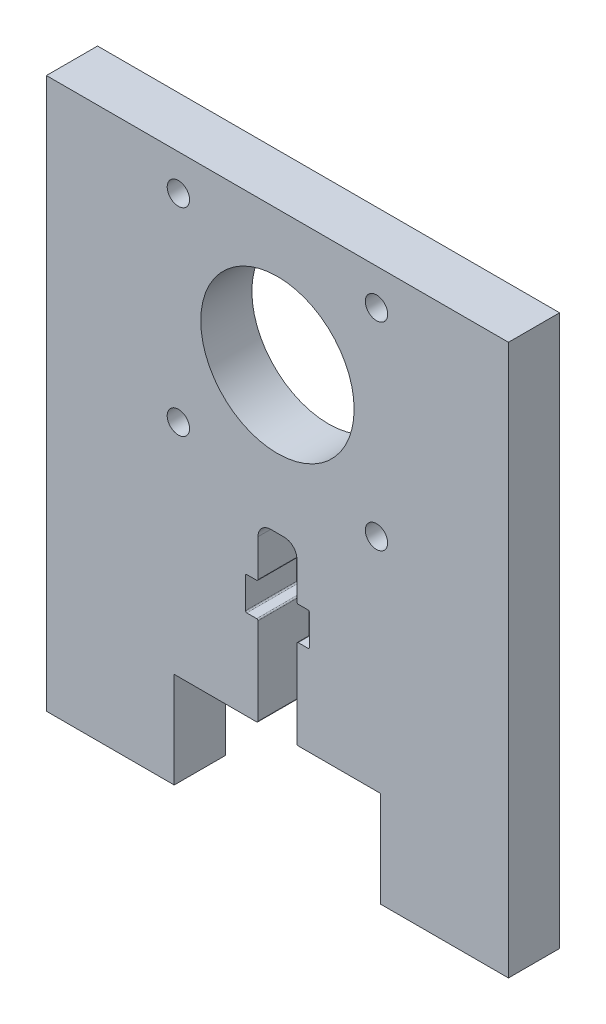
from build123d import *

# Parameters (mm, degrees)
SKETCH1_R           = 12
SKETCH1_R_2         = 1.75
BOSS_EXTRUDE1_DEPTH = 8


with BuildPart() as part:
    # Sketch1 → Boss-Extrude1 (new body)
    with BuildSketch(Plane.XY):
        with BuildLine():
            Line((36.15, 21.15), (-36.15, 21.15))
            Line((-36.15, 21.15), (-36.15, -57))
            Line((-36.15, -57), (-36.15, -65))
            Line((-36.15, -65), (-16.15, -65))
            Line((-16.15, -65), (-16.15, -50))
            Line((-16.15, -50), (-3.25, -50))
            ThreePointArc((-3.25, -50), (-3.108578644, -49.941421356), (-3.05, -49.8))
            Line((-3.05, -49.8), (-3.05, -36.2))
            ThreePointArc((-3.05, -36.2), (-3.108578644, -36.058578644), (-3.25, -36))
            Line((-3.25, -36), (-4.8, -36))
            ThreePointArc((-4.8, -36), (-4.941421356, -35.941421356), (-5, -35.8))
            Line((-5, -35.8), (-5, -31))
            ThreePointArc((-5, -31), (-4.941421356, -30.858578644), (-4.8, -30.8))
            Line((-4.8, -30.8), (-3.25, -30.8))
            ThreePointArc((-3.25, -30.8), (-3.108578644, -30.741421356), (-3.05, -30.6))
            Line((-3.05, -30.6), (-3.05, -24.8))
            ThreePointArc((-3.05, -24.8), (-2.464213562, -23.385786438), (-1.05, -22.8))
            Line((-1.05, -22.8), (1.05, -22.8))
            ThreePointArc((1.05, -22.8), (2.464213562, -23.385786438), (3.05, -24.8))
            Line((3.05, -24.8), (3.05, -30.6))
            ThreePointArc((3.05, -30.6), (3.108578644, -30.741421356), (3.25, -30.8))
            Line((3.25, -30.8), (4.8, -30.8))
            ThreePointArc((4.8, -30.8), (4.941421356, -30.858578644), (5, -31))
            Line((5, -31), (5, -35.8))
            ThreePointArc((5, -35.8), (4.941421356, -35.941421356), (4.8, -36))
            Line((4.8, -36), (3.25, -36))
            ThreePointArc((3.25, -36), (3.108578644, -36.058578644), (3.05, -36.2))
            Line((3.05, -36.2), (3.05, -49.8))
            ThreePointArc((3.05, -49.8), (3.108578644, -49.941421356), (3.25, -50))
            Line((3.25, -50), (16.15, -50))
            Line((16.15, -50), (16.15, -65))
            Line((16.15, -65), (36.15, -65))
            Line((36.15, -65), (36.15, -57))
            Line((36.15, -57), (36.15, 21.15))
        make_face()
        Circle(SKETCH1_R, mode=Mode.SUBTRACT)
        with Locations((-15.5, 15.5)):
            Circle(SKETCH1_R_2, mode=Mode.SUBTRACT)
        with Locations((15.5, 15.5)):
            Circle(SKETCH1_R_2, mode=Mode.SUBTRACT)
        with Locations((15.5, -15.5)):
            Circle(SKETCH1_R_2, mode=Mode.SUBTRACT)
        with Locations((-15.5, -15.5)):
            Circle(SKETCH1_R_2, mode=Mode.SUBTRACT)
    extrude(amount=BOSS_EXTRUDE1_DEPTH)


solid = part.part
